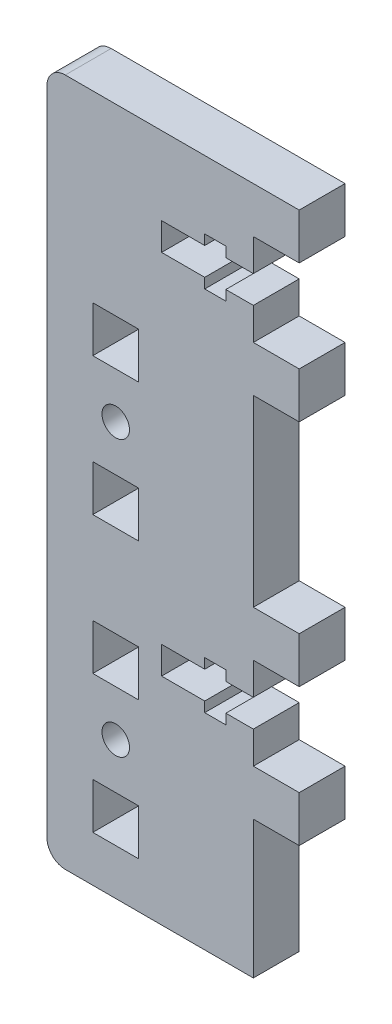
from build123d import *

# Parameters (mm, degrees)
SKETCH1_W           = 5
SKETCH1_H           = 5
SKETCH1_R           = 1.5
BOSS_EXTRUDE1_DEPTH = 5
CONG_1_R            = 2


with BuildPart() as part:
    # Sketch1 → Boss-Extrude1 (new body)
    with BuildSketch(Plane.XY):
        Polygon((22.5, 35), (22.5, 55), (27.5, 55), (27.5, 60), (22.5, 60), (22.5, 63.5), (19.5, 63.5), (19.5, 62.4), (17.2, 62.4), (17.2, 63.5), (12.5, 63.5), (12.5, 66.5), (17.2, 66.5), (17.2, 67.6), (19.5, 67.6), (19.5, 66.5), (22.5, 66.5), (22.5, 70), (27.5, 70), (27.5, 75), (22.5, 75), (0, 75), (0, 0), (22.5, 0), (22.5, 15), (27.5, 15), (27.5, 20), (22.5, 20), (22.5, 23.5), (19.5, 23.5), (19.5, 22.4), (17.2, 22.4), (17.2, 23.5), (12.5, 23.5), (12.5, 26.5), (17.2, 26.5), (17.2, 27.6), (19.5, 27.6), (19.5, 26.5), (22.5, 26.5), (22.5, 30), (27.5, 30), (27.5, 35), align=None)
        with Locations((7.5, 7.5)):
            Rectangle(SKETCH1_W, SKETCH1_H, mode=Mode.SUBTRACT)
        with Locations((7.5, 15)):
            Circle(SKETCH1_R, mode=Mode.SUBTRACT)
        with Locations((7.5, 22.5)):
            Rectangle(SKETCH1_W, SKETCH1_H, mode=Mode.SUBTRACT)
        with Locations((7.5, 37.5)):
            Rectangle(SKETCH1_W, SKETCH1_H, mode=Mode.SUBTRACT)
        with Locations((7.5, 45)):
            Circle(SKETCH1_R, mode=Mode.SUBTRACT)
        with Locations((7.5, 52.5)):
            Rectangle(SKETCH1_W, SKETCH1_H, mode=Mode.SUBTRACT)
    extrude(amount=BOSS_EXTRUDE1_DEPTH)

    # Congé1
    cong_1_edges = [part.edges().sort_by_distance(p)[0] for p in [
        (0, 0, 2.5),
        (0, 75, 2.5),
    ]]
    fillet(cong_1_edges, radius=CONG_1_R)


solid = part.part
